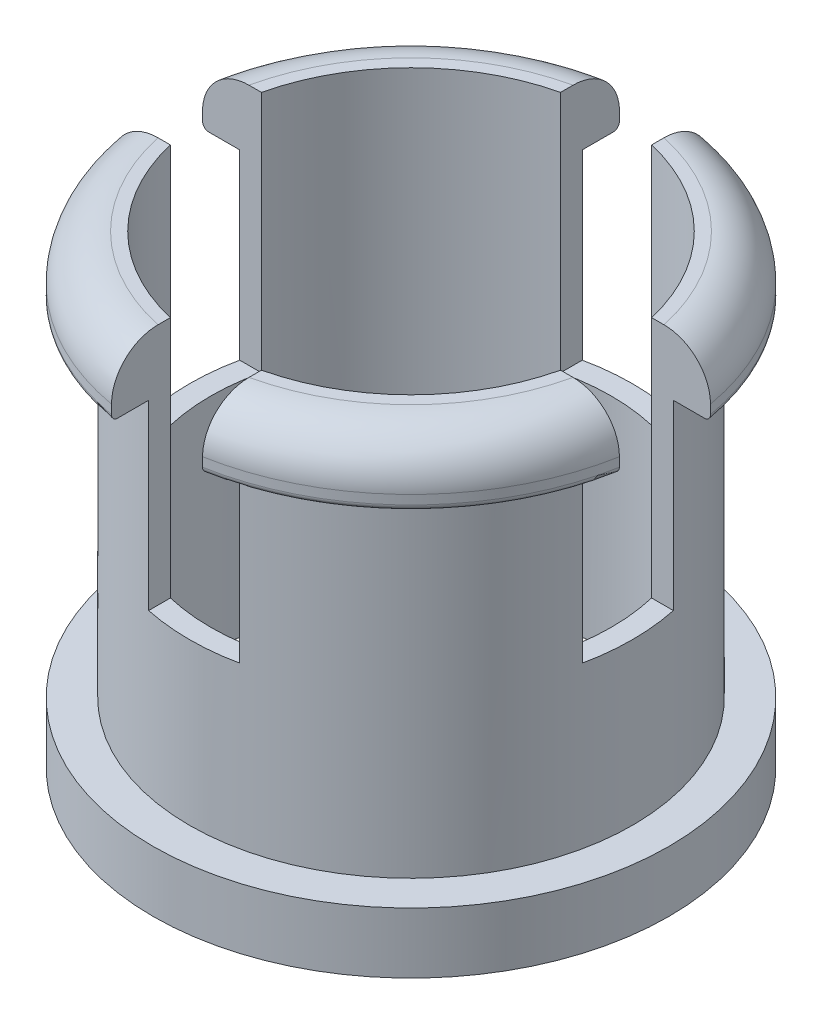
from build123d import *

# Parameters (mm, degrees)
SKETCH1_R           = 7.3
SKETCH1_R_2         = 6.6
BOSS_EXTRUDE1_DEPTH = 11.3
BOSS_EXTRUDE2_START = -2
SKETCH1_3_R         = 8.5
SKETCH1_3_R_2       = 6.6
BOSS_EXTRUDE2_DEPTH = 2
BOSS_EXTRUDE3_START = 11.3
SKETCH1_4_R         = 8.5
SKETCH1_4_R_2       = 6.6
BOSS_EXTRUDE3_DEPTH = 2
FILLET1_R           = 1.5
FILLET2_R           = 0.2
CUT_EXTRUDE1_START  = 13.3
SKETCH1_6_W         = 18
SKETCH1_6_H         = 3
CUT_EXTRUDE1_DEPTH  = 8
CUT_EXTRUDE3_START  = 13.3
SKETCH3_W           = 3
SKETCH3_H           = 22.651300202
CUT_EXTRUDE3_DEPTH  = 8


with BuildPart() as part:
    # Sketch1 → Boss-Extrude1 (new body)
    with BuildSketch(Plane(origin=(0, 0, 0), x_dir=(1, 0, 0), z_dir=(0, 1, 0))):
        with Locations(Location((0, 0, 0), (0, 0, 270))):
            Circle(SKETCH1_R)
        with Locations(Location((0, 0, 0), (0, 0, 270))):
            Circle(SKETCH1_R_2, mode=Mode.SUBTRACT)
    extrude(amount=BOSS_EXTRUDE1_DEPTH)

    # Sketch1<3> → Boss-Extrude2 (add)
    with BuildSketch(Plane(origin=(0, 0, 0), x_dir=(1, 0, 0), z_dir=(0, 1, 0)).offset(BOSS_EXTRUDE2_START)):
        with Locations(Location((0, 0, 0), (0, 0, 270))):
            Circle(SKETCH1_3_R)
        with Locations(Location((0, 0, 0), (0, 0, 270))):
            Circle(SKETCH1_3_R_2, mode=Mode.SUBTRACT)
    extrude(amount=BOSS_EXTRUDE2_DEPTH)

    # Sketch1<4> → Boss-Extrude3 (add)
    with BuildSketch(Plane(origin=(0, 0, 0), x_dir=(1, 0, 0), z_dir=(0, 1, 0)).offset(BOSS_EXTRUDE3_START)):
        with Locations(Location((0, 0, 0), (0, 0, 270))):
            Circle(SKETCH1_4_R)
        with Locations(Location((0, 0, 0), (0, 0, 270))):
            Circle(SKETCH1_4_R_2, mode=Mode.SUBTRACT)
    extrude(amount=BOSS_EXTRUDE3_DEPTH)

    # Fillet1
    fillet1_edges = [part.edges().sort_by_distance(p)[0] for p in [
        (0, 13.3, -8.5),
    ]]
    fillet(fillet1_edges, radius=FILLET1_R)

    # Fillet2
    fillet2_edges = [part.edges().sort_by_distance(p)[0] for p in [
        (0, 11.3, -8.5),
    ]]
    fillet(fillet2_edges, radius=FILLET2_R)

    # Sketch1<6> → Cut-Extrude1 (cut)
    with BuildSketch(Plane(origin=(0, 0, 0), x_dir=(1, 0, 0), z_dir=(0, 1, 0)).offset(CUT_EXTRUDE1_START)):
        Rectangle(SKETCH1_6_W, SKETCH1_6_H)
    extrude(amount=-CUT_EXTRUDE1_DEPTH, mode=Mode.SUBTRACT)

    # Sketch3 → Cut-Extrude3 (cut)
    with BuildSketch(Plane(origin=(0, 0, 0), x_dir=(1, 0, 0), z_dir=(0, 1, 0)).offset(CUT_EXTRUDE3_START)):
        Rectangle(SKETCH3_W, SKETCH3_H)
    extrude(amount=-CUT_EXTRUDE3_DEPTH, mode=Mode.SUBTRACT)


solid = part.part
